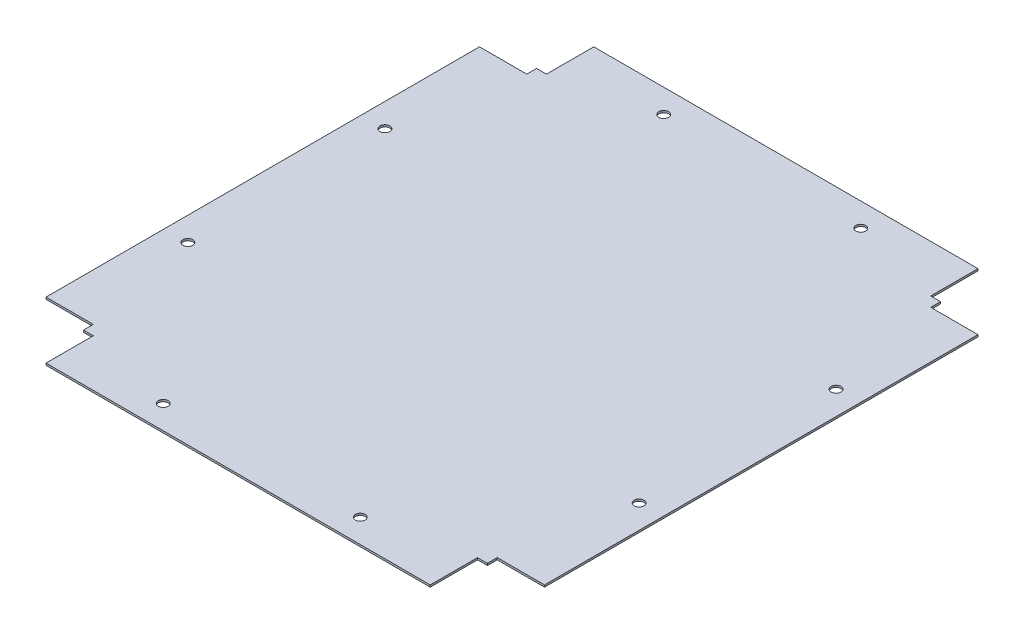
from build123d import *

# Parameters (mm, degrees)
SKETCH1_R           = 2.5
BOSS_EXTRUDE1_DEPTH = 1


with BuildPart() as part:
    # Sketch1 → Boss-Extrude1 (new body)
    with BuildSketch(Plane(origin=(0, 0, 0), x_dir=(1, 0, 0), z_dir=(0, 1, 0))):
        Polygon((-102.5, 115), (-97.5, 115), (-97.5, 139), (97.5, 139), (97.5, 115), (102.5, 115), (102.5, 110), (126.5, 110), (126.5, -110), (102.5, -110), (102.5, -115), (97.5, -115), (97.5, -139), (-97.5, -139), (-97.5, -115), (-102.5, -115), (-102.5, -110), (-126.5, -110), (-126.5, 110), (-102.5, 110), align=None)
        with Locations(Location((-114.5, -50, 0), (0, 0, 270))):
            Circle(SKETCH1_R, mode=Mode.SUBTRACT)
        with Locations(Location((-114.5, 50, 0), (0, 0, 270))):
            Circle(SKETCH1_R, mode=Mode.SUBTRACT)
        with Locations(Location((-50, 127, 0), (0, 0, 270))):
            Circle(SKETCH1_R, mode=Mode.SUBTRACT)
        with Locations(Location((50, 127, 0), (0, 0, 270))):
            Circle(SKETCH1_R, mode=Mode.SUBTRACT)
        with Locations(Location((114.5, 50, 0), (0, 0, 270))):
            Circle(SKETCH1_R, mode=Mode.SUBTRACT)
        with Locations(Location((114.5, -50, 0), (0, 0, 270))):
            Circle(SKETCH1_R, mode=Mode.SUBTRACT)
        with Locations(Location((50, -127, 0), (0, 0, 270))):
            Circle(SKETCH1_R, mode=Mode.SUBTRACT)
        with Locations(Location((-50, -127, 0), (0, 0, 270))):
            Circle(SKETCH1_R, mode=Mode.SUBTRACT)
    extrude(amount=BOSS_EXTRUDE1_DEPTH)


solid = part.part
